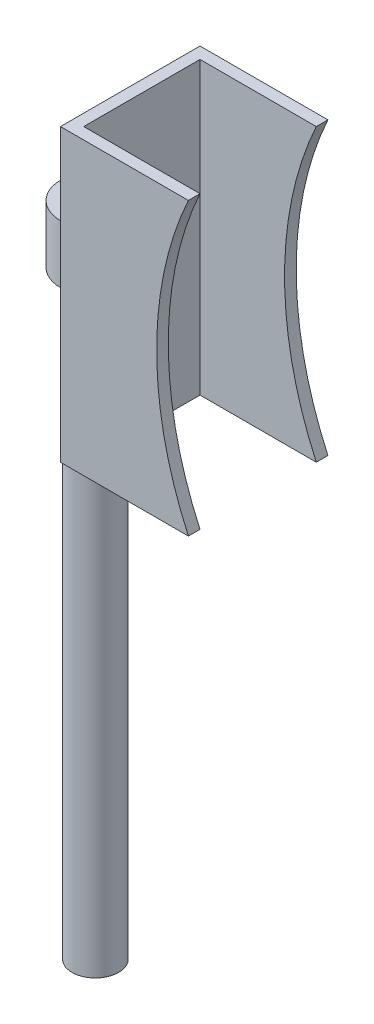
from build123d import *

# Parameters (mm, degrees)
BOSS_EXTRUDE1_DEPTH     = 50
CUT_EXTRUDE1_DEPTH      = 59.957611892
CUT_EXTRUDE1_DEPTH_BACK = 59.957611892
SKETCH3_R               = 60
BOSS_EXTRUDE2_START     = -30
SKETCH4_R               = 6
SKETCH4_R_2             = 4
BOSS_EXTRUDE2_DEPTH     = 10
BOSS_EXTRUDE3_START     = -20
SKETCH5_R               = 4
BOSS_EXTRUDE3_DEPTH     = 123


with BuildPart() as part:
    # Sketch1 → Boss-Extrude1 (new body)
    with BuildSketch(Plane(origin=(0, 0, 0), x_dir=(1, 0, 0), z_dir=(0, 1, 0))):
        Polygon((0, 0), (0, 20), (20, 20), (20, 22), (-2, 22), (-2, -2), (20, -2), (20, 0), align=None)
    extrude(amount=BOSS_EXTRUDE1_DEPTH)

    # Sketch3 → Cut-Extrude1 (cut, two sides: drawn at the far end of the back side and taken through both)
    with BuildSketch(Plane(origin=(0, 0, -22), x_dir=(-1, 0, 0), z_dir=(0, 0, -1)).offset(-CUT_EXTRUDE1_DEPTH_BACK)):
        with Locations((-74.543560573, 25)):
            Circle(SKETCH3_R)
    extrude(amount=CUT_EXTRUDE1_DEPTH + CUT_EXTRUDE1_DEPTH_BACK, mode=Mode.SUBTRACT)


with BuildPart() as body_2:
    # Sketch4 → Boss-Extrude2 (new body)
    with BuildSketch(Plane(origin=(0, 50, 0), x_dir=(1, 0, 0), z_dir=(0, 1, 0)).offset(BOSS_EXTRUDE2_START)):
        with Locations(Location((-8, 10, 0), (0, 0, 270))):
            Circle(SKETCH4_R)
        with Locations(Location((-8, 10, 0), (0, 0, 270))):
            Circle(SKETCH4_R_2, mode=Mode.SUBTRACT)
    extrude(amount=BOSS_EXTRUDE2_DEPTH)

    # Sketch5 → Boss-Extrude3 (add)
    with BuildSketch(Plane.XZ.offset(-20).offset(BOSS_EXTRUDE3_START)):
        with Locations(Location((-8, -10, 0), (0, 0, 90))):
            Circle(SKETCH5_R)
    extrude(amount=BOSS_EXTRUDE3_DEPTH)


solid = Compound([part.part, body_2.part])
